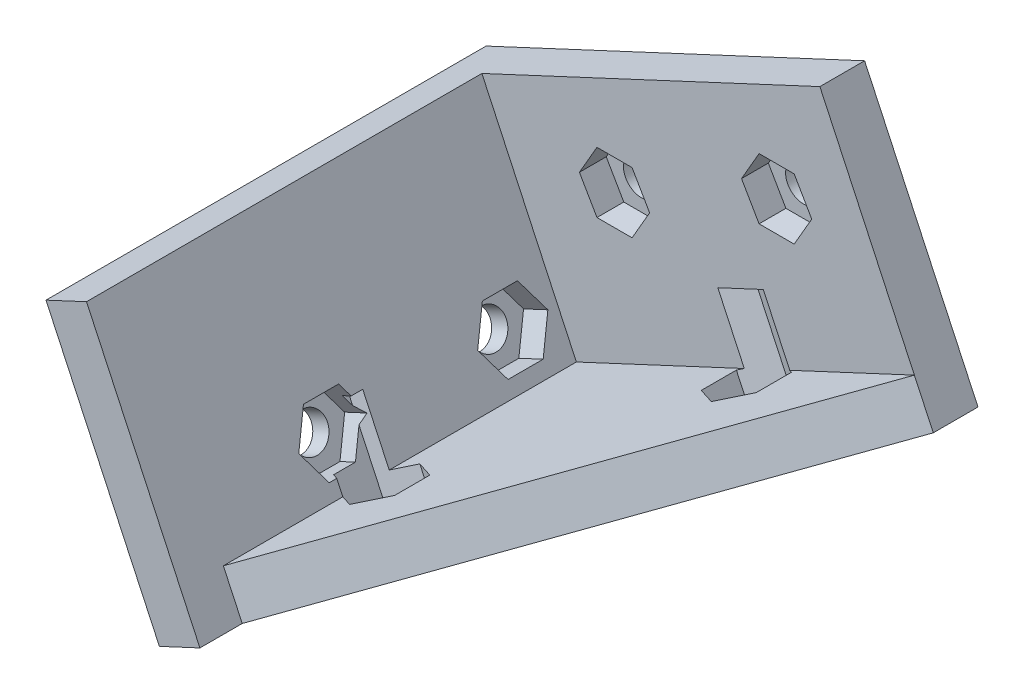
from build123d import *

# Parameters (mm, degrees)
SKETCH1_R           = 2
BOSS_EXTRUDE1_DEPTH = 2
BOSS_EXTRUDE2_START = 2
BOSS_EXTRUDE2_DEPTH = 3
SKETCH3_R           = 2
BOSS_EXTRUDE3_DEPTH = 2
BOSS_EXTRUDE4_START = 2
BOSS_EXTRUDE4_DEPTH = 3
SKETCH4_W           = 44.205836774
SKETCH4_H           = 30
SKETCH4_R           = 2
BOSS_EXTRUDE5_DEPTH = 2
BOSS_EXTRUDE6_START = 2
SKETCH4_4_W         = 44.205836774
SKETCH4_4_H         = 30
BOSS_EXTRUDE6_DEPTH = 3
CUT_EXTRUDE1_START  = 2
SKETCH3_5_R         = 2
CUT_EXTRUDE1_DEPTH  = 10


with BuildPart() as part:
    # Sketch1 → Boss-Extrude1 (new body)
    # profile 1 of 3: a face of its own
    with BuildSketch(Plane.XY):
        Polygon((15.156849888, -300.73734036), (-27.167723767, -320.473613183), (-39.846271619, -293.284379572), (2.478302036, -273.548106749), align=None)
        Polygon((-22.447739873, -291.889732471), (-24.410730789, -295.289732471), (-22.447739873, -298.689732471), (-18.521758043, -298.689732471), (-16.558767128, -295.289732471), (-18.521758043, -291.889732471), align=None, mode=Mode.SUBTRACT)
        Polygon((-4.321584133, -283.437367237), (-6.284575048, -286.837367237), (-4.321584133, -290.237367237), (-0.395602302, -290.237367237), (1.567388613, -286.837367237), (-0.395602302, -283.437367237), align=None, mode=Mode.SUBTRACT)
    # profile 2 of 3: a face of its own
    with BuildSketch(Plane.XY):
        Polygon((-0.395602302, -283.437367237), (-4.321584133, -283.437367237), (-6.284575048, -286.837367237), (-4.321584133, -290.237367237), (-0.395602302, -290.237367237), (1.567388613, -286.837367237), align=None)
        with Locations((-2.358593217, -286.837367237)):
            Circle(SKETCH1_R, mode=Mode.SUBTRACT)
    # profile 3 of 3: a face of its own
    with BuildSketch(Plane.XY):
        Polygon((-18.521758043, -291.889732471), (-22.447739873, -291.889732471), (-24.410730789, -295.289732471), (-22.447739873, -298.689732471), (-18.521758043, -298.689732471), (-16.558767128, -295.289732471), align=None)
        with Locations((-20.484748958, -295.289732471)):
            Circle(SKETCH1_R, mode=Mode.SUBTRACT)
    extrude(amount=BOSS_EXTRUDE1_DEPTH)

    # Sketch1<3> → Boss-Extrude2 (add)
    with BuildSketch(Plane.XY.offset(BOSS_EXTRUDE2_START)):
        Polygon((15.156849888, -300.73734036), (-27.167723767, -320.473613183), (-39.846271619, -293.284379572), (2.478302036, -273.548106749), align=None)
        Polygon((-22.447739873, -291.889732471), (-24.410730789, -295.289732471), (-22.447739873, -298.689732471), (-18.521758043, -298.689732471), (-16.558767128, -295.289732471), (-18.521758043, -291.889732471), align=None, mode=Mode.SUBTRACT)
        Polygon((-4.321584133, -283.437367237), (-6.284575048, -286.837367237), (-4.321584133, -290.237367237), (-0.395602302, -290.237367237), (1.567388613, -286.837367237), (-0.395602302, -283.437367237), align=None, mode=Mode.SUBTRACT)
    extrude(amount=BOSS_EXTRUDE2_DEPTH)

    # Sketch3 → Boss-Extrude3 (add)
    # profile 1 of 3: a face of its own
    with BuildSketch(Plane(origin=(117.8961915, -252.829198573, 0), x_dir=(0.9063077870366509, 0.42261826174069744, 0), z_dir=(-0.42261826174069744, 0.9063077870366509, 0))):
        Polygon((-113.360320943, 0), (-160.060320943, 0), (-160.060320943, -5), (-160.060320943, -49.205836774), (-113.360320943, -5), align=None)
        Polygon((-149.353719225, -30.482796069), (-149.353719225, -26.556814238), (-152.753719225, -24.593823323), (-156.153719225, -26.556814238), (-156.153719225, -30.482796069), (-152.753719225, -32.445786984), align=None, mode=Mode.SUBTRACT)
        Polygon((-128.14051579, -5.343610803), (-131.54051579, -3.380619887), (-134.94051579, -5.343610803), (-134.94051579, -9.269592633), (-131.54051579, -11.232583548), (-128.14051579, -9.269592633), align=None, mode=Mode.SUBTRACT)
    # profile 2 of 3: a face of its own
    with BuildSketch(Plane(origin=(117.8961915, -252.829198573, 0), x_dir=(0.9063077870366509, 0.42261826174069744, 0), z_dir=(-0.42261826174069744, 0.9063077870366509, 0))):
        Polygon((-128.14051579, -5.343610803), (-128.735667158, -5), (-134.345364422, -5), (-134.94051579, -5.343610803), (-134.94051579, -9.269592633), (-131.54051579, -11.232583548), (-128.14051579, -9.269592633), align=None)
        with Locations(Location((-131.54051579, -7.306601718, 0), (0, 0, 180))):
            Circle(SKETCH3_R, mode=Mode.SUBTRACT)
    # profile 3 of 3: a face of its own
    with BuildSketch(Plane(origin=(117.8961915, -252.829198573, 0), x_dir=(0.9063077870366509, 0.42261826174069744, 0), z_dir=(-0.42261826174069744, 0.9063077870366509, 0))):
        Polygon((-149.353719225, -30.482796069), (-149.353719225, -26.556814238), (-152.753719225, -24.593823323), (-156.153719225, -26.556814238), (-156.153719225, -30.482796069), (-152.753719225, -32.445786984), align=None)
        with Locations(Location((-152.753719225, -28.519805153, 0), (0, 0, 180))):
            Circle(SKETCH3_R, mode=Mode.SUBTRACT)
    extrude(amount=BOSS_EXTRUDE3_DEPTH)

    # Sketch3<4> → Boss-Extrude4 (add)
    with BuildSketch(Plane(origin=(117.8961915, -252.829198573, 0), x_dir=(0.9063077870366509, 0.42261826174069744, 0), z_dir=(-0.42261826174069744, 0.9063077870366509, 0)).offset(BOSS_EXTRUDE4_START)):
        Polygon((-113.360320943, 0), (-160.060320943, 0), (-160.060320943, -5), (-160.060320943, -49.205836774), (-113.360320943, -5), align=None)
        Polygon((-149.353719225, -30.482796069), (-149.353719225, -26.556814238), (-152.753719225, -24.593823323), (-156.153719225, -26.556814238), (-156.153719225, -30.482796069), (-152.753719225, -32.445786984), align=None, mode=Mode.SUBTRACT)
        Polygon((-128.14051579, -5.343610803), (-131.54051579, -3.380619887), (-134.94051579, -5.343610803), (-134.94051579, -9.269592633), (-131.54051579, -11.232583548), (-128.14051579, -9.269592633), align=None, mode=Mode.SUBTRACT)
    extrude(amount=BOSS_EXTRUDE4_DEPTH)

    # Sketch4 → Boss-Extrude5 (add)
    # profile 1 of 3: a face of its own
    with BuildSketch(Plane(origin=(-145.063915266, -67.644414611, 0), x_dir=(0, 0, -1), z_dir=(0.9063077870366509, 0.42261826174069744, 1.6586764924388181e-15))):
        with Locations((-27.102918387, -263.966154974)):
            Rectangle(SKETCH4_W, SKETCH4_H)
        Polygon((-31.962990915, -272.366154974), (-33.92598183, -268.966154974), (-31.962990915, -265.566154974), (-28.037009085, -265.566154974), (-26.07401817, -268.966154974), (-28.037009085, -272.366154974), align=None, mode=Mode.SUBTRACT)
        Polygon((-11.962990915, -272.366154974), (-13.92598183, -268.966154974), (-11.962990915, -265.566154974), (-8.037009085, -265.566154974), (-6.07401817, -268.966154974), (-8.037009085, -272.366154974), align=None, mode=Mode.SUBTRACT)
    # profile 2 of 3: a face of its own
    with BuildSketch(Plane(origin=(-145.063915266, -67.644414611, 0), x_dir=(0, 0, -1), z_dir=(0.9063077870366509, 0.42261826174069744, 1.6586764924388181e-15))):
        Polygon((-28.037009085, -265.566154974), (-31.962990915, -265.566154974), (-33.92598183, -268.966154974), (-31.962990915, -272.366154974), (-28.037009085, -272.366154974), (-26.07401817, -268.966154974), align=None)
        with Locations(Location((-30, -268.966154974, 0), (0, 0, 90))):
            Circle(SKETCH4_R, mode=Mode.SUBTRACT)
    # profile 3 of 3: a face of its own
    with BuildSketch(Plane(origin=(-145.063915266, -67.644414611, 0), x_dir=(0, 0, -1), z_dir=(0.9063077870366509, 0.42261826174069744, 1.6586764924388181e-15))):
        Polygon((-8.037009085, -265.566154974), (-11.962990915, -265.566154974), (-13.92598183, -268.966154974), (-11.962990915, -272.366154974), (-8.037009085, -272.366154974), (-6.07401817, -268.966154974), align=None)
        with Locations(Location((-10, -268.966154974, 0), (0, 0, 90))):
            Circle(SKETCH4_R, mode=Mode.SUBTRACT)
    extrude(amount=BOSS_EXTRUDE5_DEPTH)

    # Sketch4<4> → Boss-Extrude6 (add)
    with BuildSketch(Plane(origin=(-145.063915266, -67.644414611, 0), x_dir=(0, 0, -1), z_dir=(0.9063077870366509, 0.42261826174069744, 1.6586764924388181e-15)).offset(BOSS_EXTRUDE6_START)):
        with Locations((-27.102918387, -263.966154974)):
            Rectangle(SKETCH4_4_W, SKETCH4_4_H)
        Polygon((-31.962990915, -272.366154974), (-33.92598183, -268.966154974), (-31.962990915, -265.566154974), (-28.037009085, -265.566154974), (-26.07401817, -268.966154974), (-28.037009085, -272.366154974), align=None, mode=Mode.SUBTRACT)
        Polygon((-11.962990915, -272.366154974), (-13.92598183, -268.966154974), (-11.962990915, -265.566154974), (-8.037009085, -265.566154974), (-6.07401817, -268.966154974), (-8.037009085, -272.366154974), align=None, mode=Mode.SUBTRACT)
    extrude(amount=BOSS_EXTRUDE6_DEPTH)

    # Sketch3<5> → Cut-Extrude1 (cut)
    # profile 1 of 2: a face of its own
    with BuildSketch(Plane(origin=(117.8961915, -252.829198573, 0), x_dir=(0.9063077870366509, 0.42261826174069744, 0), z_dir=(-0.42261826174069744, 0.9063077870366509, 0)).offset(CUT_EXTRUDE1_START)):
        Polygon((-128.14051579, -5.343610803), (-131.54051579, -3.380619887), (-134.94051579, -5.343610803), (-134.94051579, -9.269592633), (-131.54051579, -11.232583548), (-128.14051579, -9.269592633), align=None)
        with Locations(Location((-131.54051579, -7.306601718, 0), (0, 0, 180))):
            Circle(SKETCH3_5_R, mode=Mode.SUBTRACT)
    # profile 2 of 2: a face of its own
    with BuildSketch(Plane(origin=(117.8961915, -252.829198573, 0), x_dir=(0.9063077870366509, 0.42261826174069744, 0), z_dir=(-0.42261826174069744, 0.9063077870366509, 0)).offset(CUT_EXTRUDE1_START)):
        Polygon((-149.353719225, -30.482796069), (-149.353719225, -26.556814238), (-152.753719225, -24.593823323), (-156.153719225, -26.556814238), (-156.153719225, -30.482796069), (-152.753719225, -32.445786984), align=None)
        with Locations(Location((-152.753719225, -28.519805153, 0), (0, 0, 180))):
            Circle(SKETCH3_5_R, mode=Mode.SUBTRACT)
    extrude(amount=CUT_EXTRUDE1_DEPTH, mode=Mode.SUBTRACT)


solid = part.part
